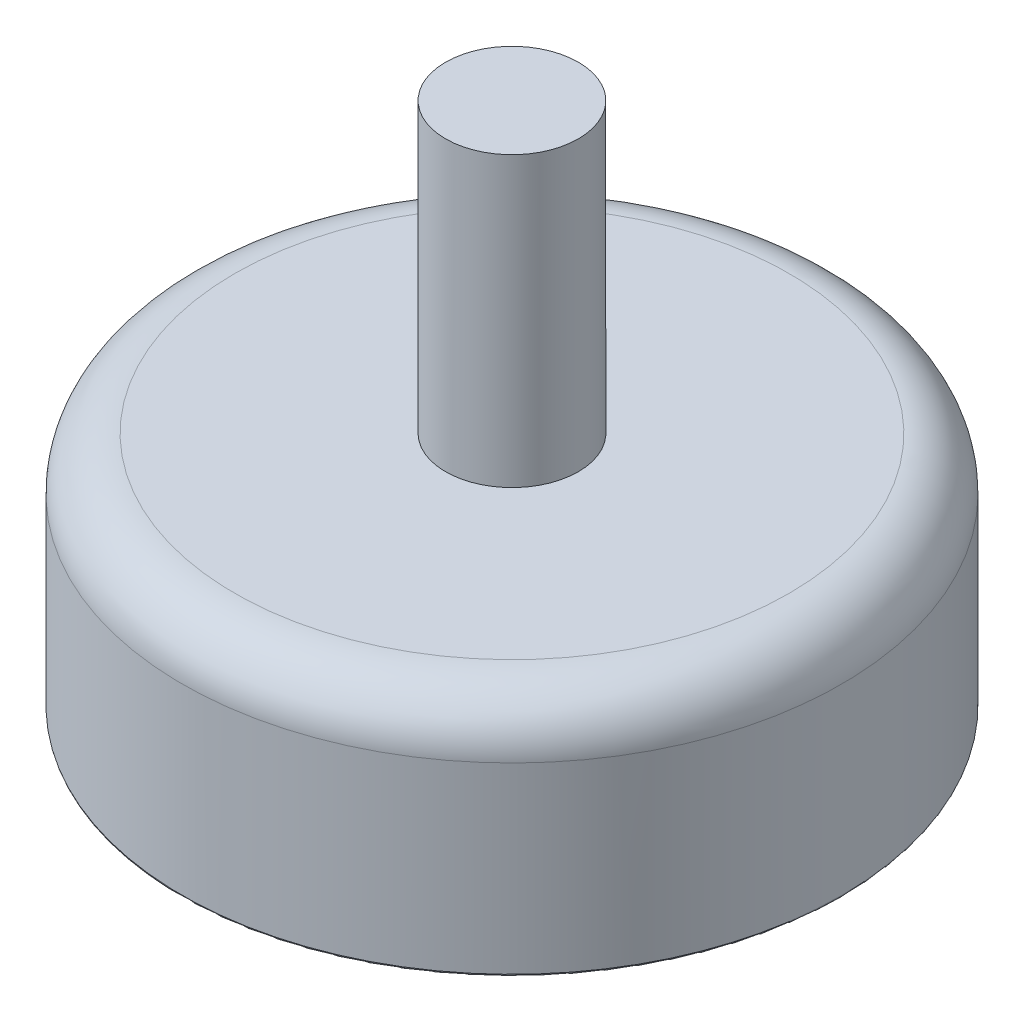
from build123d import *

# Parameters (mm, degrees)
SKETCH2_R           = 1.9
BOSS_EXTRUDE1_DEPTH = 8.25
FILLET1_R           = 0.0635


with BuildPart() as part:
    # Sketch1 → Revolve1 (revolve)
    with BuildSketch(Plane.XY):
        with BuildLine():
            Line((-9.43, 0), (-8.16, 0))
            Line((-8.16, 0), (-8.16, 0.6))
            Line((-8.16, 0.6), (-6.8, 0.6))
            Line((-6.8, 0.6), (-6.8, 0.5))
            Line((-6.8, 0.5), (0, 0.5))
            Line((0, 0.5), (0, 6.8))
            Line((0, 6.8), (-7.93, 6.8))
            ThreePointArc((-7.93, 6.8), (-8.990660172, 6.360660172), (-9.43, 5.3))
            Line((-9.43, 5.3), (-9.43, 0))
        make_face()
    revolve(axis=Axis((0, 6.8, 0), (0, -1, 0)))

    # Sketch2 → Boss-Extrude1 (add)
    with BuildSketch(Plane(origin=(0, 6.8, 0), x_dir=(1, 0, 0), z_dir=(0, 1, 0))):
        Circle(SKETCH2_R)
    extrude(amount=BOSS_EXTRUDE1_DEPTH)

    # Fillet1
    fillet1_edges = [part.edges().sort_by_distance(p)[0] for p in [
        (8.16, 0.6, 0),
        (8.16, 0, 0),
        (9.43, 0, 0),
        (6.8, 0.5, 0),
    ]]
    fillet(fillet1_edges, radius=FILLET1_R)


solid = part.part
